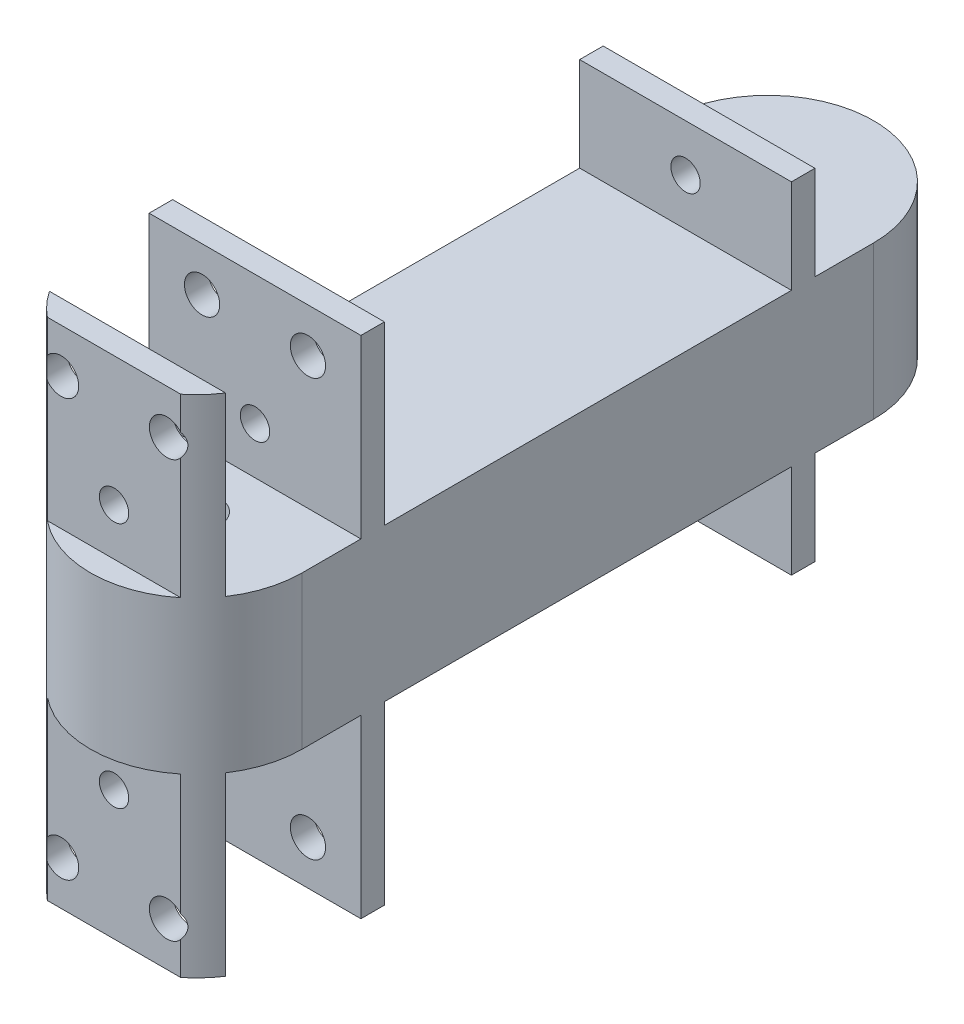
from build123d import *

# Parameters (mm, degrees)
SKETCH1_R                      = 4
BOSS_EXTRUDE1_DEPTH            = 3
BOSS_EXTRUDE3_DEPTH            = 20
BOSS_EXTRUDE4_START            = 30
SKETCH4_W                      = 36.05
SKETCH4_H                      = 4
BOSS_EXTRUDE4_DEPTH            = 30
SKETCH6_W                      = 36.05
SKETCH6_H                      = 4
BOSS_EXTRUDE5_DEPTH            = 16
CUT_EXTRUDE2_REACH             = 109.19
SKETCH5_R                      = 2.5
SKETCH5_R_2                    = 3
CUT_EXTRUDE2_DIRECTION_2_REACH = 109.19


with BuildPart() as part:
    # Sketch1 → Boss-Extrude1 (new body)
    with BuildSketch(Plane(origin=(0, 0, 0), x_dir=(1, 0, 0), z_dir=(0, 1, 0))):
        with BuildLine():
            Line((-18.025, 0), (-18.025, 97.29))
            ThreePointArc((-18.025, 97.29), (0, 115.315), (18.025, 97.29))
            Line((18.025, 97.29), (18.025, 0))
            ThreePointArc((18.025, 0), (0, -18.025), (-18.025, 0))
        make_face()
        with Locations(Location((0, 0, 0), (0, 0, 270))):
            Circle(SKETCH1_R, mode=Mode.SUBTRACT)
        with Locations(Location((0, 97.29, 0), (0, 0, 90))):
            Circle(SKETCH1_R, mode=Mode.SUBTRACT)
    boss_extrude1 = extrude(amount=BOSS_EXTRUDE1_DEPTH)

    # Sketch3 → Boss-Extrude3 (add)
    with BuildSketch(Plane(origin=(0, 3, 0), x_dir=(1, 0, 0), z_dir=(0, 1, 0))):
        with BuildLine():
            Line((-15.025, 0), (-18.025, 0))
            ThreePointArc((-18.025, 0), (0, -18.025), (18.025, 0))
            Line((18.025, 0), (18.025, 97.29))
            ThreePointArc((18.025, 97.29), (12.745599731, 110.035599731), (0, 115.315))
            Line((0, 115.315), (0, 112.315))
            ThreePointArc((0, 112.315), (10.624279387, 107.914279387), (15.025, 97.29))
            Line((15.025, 97.29), (15.025, 0))
            ThreePointArc((15.025, 0), (0, -15.025), (-15.025, 0))
        make_face()
    extrude(amount=BOSS_EXTRUDE3_DEPTH)

    # Mirror1: Boss-Extrude1 across plane
    add(boss_extrude1.mirror(Plane.ZX.offset(13)))

    # Sketch4 → Boss-Extrude4 (add)
    with BuildSketch(Plane.XZ.offset(BOSS_EXTRUDE4_START)):
        with Locations((0, -12)):
            Rectangle(SKETCH4_W, SKETCH4_H)
        with BuildLine():
            Line((-14.996687134, 10), (14.996687134, 10))
            ThreePointArc((14.996687134, 10), (13.326001448, 12.137475454), (11.353441108, 14))
            Line((11.353441108, 14), (-11.353441108, 14))
            ThreePointArc((-11.353441108, 14), (-13.326001448, 12.137475454), (-14.996687134, 10))
        make_face()
    boss_extrude4 = extrude(amount=-BOSS_EXTRUDE4_DEPTH)

    # Sketch6 → Boss-Extrude5 (add)
    with BuildSketch(Plane.XZ):
        with Locations((0, -12)):
            Rectangle(SKETCH6_W, SKETCH6_H)
        with Locations((0, -85.29)):
            Rectangle(SKETCH6_W, SKETCH6_H)
    boss_extrude5 = extrude(amount=BOSS_EXTRUDE5_DEPTH)

    # Cut-Extrude2: up to this face of the body (flat: up to its plane)
    cut_extrude2_end = Plane(part.part.faces().sort_by_distance((0, -15, 14))[0])
    # Sketch5 → Cut-Extrude2 (cut, up to the picked face)
    with BuildSketch(Plane(origin=(0, 0, -14), x_dir=(-1, 0, 0), z_dir=(0, 0, -1)), mode=Mode.PRIVATE) as cut_extrude2_sk1:
        with Locations((0, -8)):
            Circle(SKETCH5_R)
    cut_extrude2_tool1 = split(extrude(cut_extrude2_sk1.sketch, amount=-CUT_EXTRUDE2_REACH, mode=Mode.PRIVATE), bisect_by=cut_extrude2_end, keep=Keep.BOTH, mode=Mode.PRIVATE)
    # Sketch5 → Cut-Extrude2 (cut, up to the picked face)
    with BuildSketch(Plane(origin=(0, 0, -14), x_dir=(-1, 0, 0), z_dir=(0, 0, -1)), mode=Mode.PRIVATE) as cut_extrude2_sk2:
        with Locations(Location((-9.0125, -22.5, 0), (0, 0, 218.710740726))):
            Circle(SKETCH5_R_2)
    cut_extrude2_tool2 = split(extrude(cut_extrude2_sk2.sketch, amount=-CUT_EXTRUDE2_REACH, mode=Mode.PRIVATE), bisect_by=cut_extrude2_end, keep=Keep.BOTH, mode=Mode.PRIVATE)
    # Sketch5 → Cut-Extrude2 (cut, up to the picked face)
    with BuildSketch(Plane(origin=(0, 0, -14), x_dir=(-1, 0, 0), z_dir=(0, 0, -1)), mode=Mode.PRIVATE) as cut_extrude2_sk3:
        with Locations(Location((9.0125, -22.5, 0), (0, 0, 321.289306711))):
            Circle(SKETCH5_R_2)
    cut_extrude2_tool3 = split(extrude(cut_extrude2_sk3.sketch, amount=-CUT_EXTRUDE2_REACH, mode=Mode.PRIVATE), bisect_by=cut_extrude2_end, keep=Keep.BOTH, mode=Mode.PRIVATE)
    cut_extrude2_1 = cut_extrude2_tool1.solids().sort_by(Axis((0, -8, -14), (0, 0, 1)))[0]
    add(cut_extrude2_1, mode=Mode.SUBTRACT)
    cut_extrude2_2 = cut_extrude2_tool2.solids().sort_by(Axis((9.0125, -22.5, -14), (0, 0, 1)))[0]
    add(cut_extrude2_2, mode=Mode.SUBTRACT)
    cut_extrude2_3 = cut_extrude2_tool3.solids().sort_by(Axis((-9.0125, -22.5, -14), (0, 0, 1)))[0]
    add(cut_extrude2_3, mode=Mode.SUBTRACT)
    cut_extrude2 = cut_extrude2_1 + cut_extrude2_2 + cut_extrude2_3  # Cut-Extrude2 as one shape, for the pattern or mirror that repeats it

    # Cut-Extrude2 direction 2: up to this face of the body (flat: up to its plane)
    cut_extrude2_direction_2_end = Plane(part.part.faces().sort_by_distance((0, -8, -87.29))[0])
    # Sketch5 → Cut-Extrude2 direction 2 (cut, up to the picked face)
    with BuildSketch(Plane(origin=(0, 0, -14), x_dir=(-1, 0, 0), z_dir=(0, 0, -1)), mode=Mode.PRIVATE) as cut_extrude2_direction_2_sk1:
        with Locations((0, -8)):
            Circle(SKETCH5_R)
    cut_extrude2_direction_2_tool1 = split(extrude(cut_extrude2_direction_2_sk1.sketch, amount=CUT_EXTRUDE2_DIRECTION_2_REACH, mode=Mode.PRIVATE), bisect_by=cut_extrude2_direction_2_end, keep=Keep.BOTH, mode=Mode.PRIVATE)
    # Sketch5 → Cut-Extrude2 direction 2 (cut, up to the picked face)
    with BuildSketch(Plane(origin=(0, 0, -14), x_dir=(-1, 0, 0), z_dir=(0, 0, -1)), mode=Mode.PRIVATE) as cut_extrude2_direction_2_sk2:
        with Locations(Location((-9.0125, -22.5, 0), (0, 0, 218.710740726))):
            Circle(SKETCH5_R_2)
    cut_extrude2_direction_2_tool2 = split(extrude(cut_extrude2_direction_2_sk2.sketch, amount=CUT_EXTRUDE2_DIRECTION_2_REACH, mode=Mode.PRIVATE), bisect_by=cut_extrude2_direction_2_end, keep=Keep.BOTH, mode=Mode.PRIVATE)
    # Sketch5 → Cut-Extrude2 direction 2 (cut, up to the picked face)
    with BuildSketch(Plane(origin=(0, 0, -14), x_dir=(-1, 0, 0), z_dir=(0, 0, -1)), mode=Mode.PRIVATE) as cut_extrude2_direction_2_sk3:
        with Locations(Location((9.0125, -22.5, 0), (0, 0, 321.289306711))):
            Circle(SKETCH5_R_2)
    cut_extrude2_direction_2_tool3 = split(extrude(cut_extrude2_direction_2_sk3.sketch, amount=CUT_EXTRUDE2_DIRECTION_2_REACH, mode=Mode.PRIVATE), bisect_by=cut_extrude2_direction_2_end, keep=Keep.BOTH, mode=Mode.PRIVATE)
    cut_extrude2_direction_2_1 = cut_extrude2_direction_2_tool1.solids().sort_by(Axis((0, -8, -14), (0, 0, -1)))[0]
    add(cut_extrude2_direction_2_1, mode=Mode.SUBTRACT)
    cut_extrude2_direction_2_2 = cut_extrude2_direction_2_tool2.solids().sort_by(Axis((9.0125, -22.5, -14), (0, 0, -1)))[0]
    add(cut_extrude2_direction_2_2, mode=Mode.SUBTRACT)
    cut_extrude2_direction_2_3 = cut_extrude2_direction_2_tool3.solids().sort_by(Axis((-9.0125, -22.5, -14), (0, 0, -1)))[0]
    add(cut_extrude2_direction_2_3, mode=Mode.SUBTRACT)
    cut_extrude2_direction_2 = cut_extrude2_direction_2_1 + cut_extrude2_direction_2_2 + cut_extrude2_direction_2_3  # Cut-Extrude2 direction 2 as one shape, for the pattern or mirror that repeats it

    # Mirror3: Boss-Extrude4, Boss-Extrude5, Cut-Extrude2, Cut-Extrude2 direction 2 across plane
    add(boss_extrude4.mirror(Plane.ZX.offset(13)))
    add(boss_extrude5.mirror(Plane.ZX.offset(13)))
    add(cut_extrude2.mirror(Plane.ZX.offset(13)), mode=Mode.SUBTRACT)
    add(cut_extrude2_direction_2.mirror(Plane.ZX.offset(13)), mode=Mode.SUBTRACT)


solid = part.part
